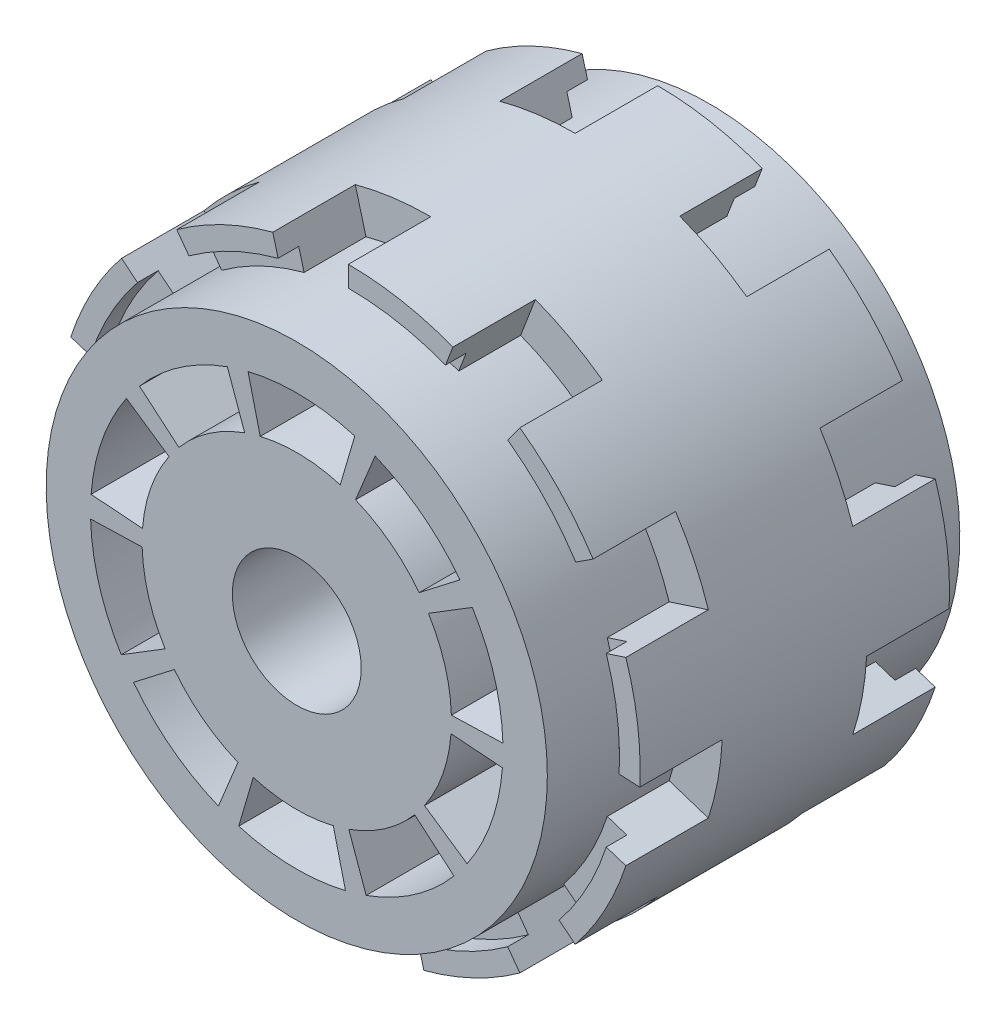
from build123d import *
from build123d.topology import SkipClean

# Parameters (mm, degrees)
SKETCH_1_R               = 28.3
EXTRUDE_1_DEPTH          = 30
SKETCH_4_R               = 24.3
EXTRUDE_2_DEPTH          = 5
EXTRUDE_START            = 5
SKETCH_5_R               = 24.3
EXTRUDE_3_DEPTH          = 5
SKETCH_21_R              = 6.25
CUT_EXTRUDE_11_DEPTH     = 13
SKETCH_23_R              = 2.1
CUT_EXTRUDE_13_DEPTH     = 57.584273434
CUT_EXTRUDE_14_DEPTH     = 47.210280242
SKETCH_27_R              = 22
CUT_EXTRUDE_15_DEPTH     = 7
CUT_EXTRUDE_16_DEPTH     = 57.584273434
CUT_EXTRUDE_17_DEPTH     = 8
PATTERN_CIRCULAR_3_COUNT = 10
CUT_EXTRUDE_START        = -8
CUT_EXTRUDE_19_DEPTH     = 8
PATTERN_CIRCULAR_4_COUNT = 10
CUT_EXTRUDE_START_2      = -2
CUT_EXTRUDE_20_DEPTH     = 2
PATTERN_CIRCULAR_5_COUNT = 10
CUT_EXTRUDE_21_DEPTH     = 2
PATTERN_CIRCULAR_6_COUNT = 10


with BuildPart() as part:
    # 草图1 → 凸台-拉伸1 (new body)
    with BuildSketch(Plane.XY):
        Circle(SKETCH_1_R)
    extrude(amount=EXTRUDE_1_DEPTH)

    # 草图4 → 凸台-拉伸2 (add)
    with BuildSketch(Plane.XY.offset(30)):
        Circle(SKETCH_4_R)
    extrude(amount=EXTRUDE_2_DEPTH)

    # 草图5 → 凸台-拉伸3 (add)
    with BuildSketch(Plane(origin=(0, 0, 0), x_dir=(-1, 0, 0), z_dir=(0, 0, -1)).offset(EXTRUDE_START)):
        with Locations(Location((0, 0, 0), (0, 0, 180))):
            Circle(SKETCH_5_R)
    extrude(amount=-EXTRUDE_3_DEPTH)

    # 草图21 → 切除-拉伸11 (cut)
    with BuildSketch(Plane.XY.offset(35)):
        Circle(SKETCH_21_R)
    extrude(amount=-CUT_EXTRUDE_11_DEPTH, mode=Mode.SUBTRACT)

    # 草图23 → 切除-拉伸13 (cut, through all)
    with BuildSketch(Plane.XY.offset(35)):
        Circle(SKETCH_23_R)
    extrude(amount=-CUT_EXTRUDE_13_DEPTH, mode=Mode.SUBTRACT)

    # 草图26 → 切除-拉伸14 (cut, through all)
    with BuildSketch(Plane.XY.offset(11.9)):
        Polygon((6.912296637, -1.386598427), (4.656977781, 5.292925273), (-2.255318856, 6.6795237), (-6.912296637, 1.386598427), (-4.656977781, -5.292925273), (2.255318856, -6.6795237), align=None)
    extrude(amount=-CUT_EXTRUDE_14_DEPTH, mode=Mode.SUBTRACT)

    # 草图27 → 切除-拉伸15 (cut)
    with BuildSketch(Plane(origin=(0, 0, -5), x_dir=(-1, 0, 0), z_dir=(0, 0, -1))):
        Circle(SKETCH_27_R)
    extrude(amount=-CUT_EXTRUDE_15_DEPTH, mode=Mode.SUBTRACT)

    # 草图31 → 切除-旋转8 (revolve, cut)
    with BuildSketch(Plane(origin=(0, 0, 0), x_dir=(1, 0, 0), z_dir=(0, 1, 0))):
        with BuildLine():
            Line((0, -2), (0, -7))
            add(Edge.make_bspline(
                [(-22, -2), (-11, -7), (0, -7)],
                knots=[0, 0, 0, 0.5, 0.5, 0.5], degree=2))
            Line((-22, -2), (0, -2))
        make_face()
    revolve(axis=Axis((0, 0, -8.390442445), (0, 0, 1)), mode=Mode.SUBTRACT)

    # 草图32 → 切除-拉伸16 (cut, through all)
    with BuildSketch(Plane.XY.offset(35)):
        with BuildLine():
            Line((-3.543658944, 14.575406728), (-4.724878592, 19.433875637))
            ThreePointArc((-4.724878592, 19.433875637), (0.465974877, 19.994570948), (5.625072928, 19.192669292))
            Line((5.625072928, 19.192669292), (4.218804696, 14.394501969))
            ThreePointArc((4.218804696, 14.394501969), (0.349481158, 14.995928211), (-3.543658944, 14.575406728))
        make_face()
        with BuildLine():
            Line((5.700328813, 13.874662209), (7.600438417, 18.499549613))
            ThreePointArc((7.600438417, 18.499549613), (12.129495524, 15.902054532), (15.831947555, 12.220860714))
            Line((15.831947555, 12.220860714), (11.873960667, 9.165645536))
            ThreePointArc((11.873960667, 9.165645536), (9.097121643, 11.926540899), (5.700328813, 13.874662209))
        make_face()
        with BuildLine():
            Line((12.76698471, 7.874268309), (17.022646281, 10.499024412))
            ThreePointArc((17.022646281, 10.499024412), (19.159961147, 5.735493775), (19.991556325, 0.581098716))
            Line((19.991556325, 0.581098716), (14.993667244, 0.435824037))
            ThreePointArc((14.993667244, 0.435824037), (14.36997086, 4.301620331), (12.76698471, 7.874268309))
        make_face()
        with BuildLine():
            Line((14.957086382, -1.133828449), (19.942781843, -1.511771265))
            ThreePointArc((19.942781843, -1.511771265), (18.871972835, -6.621830662), (16.515070066, -11.280623242))
            Line((16.515070066, -11.280623242), (12.386302549, -8.460467431))
            ThreePointArc((12.386302549, -8.460467431), (14.153979626, -4.966372996), (14.957086382, -1.133828449))
        make_face()
        with BuildLine():
            Line((11.434089429, -9.708841276), (15.245452572, -12.945121702))
            ThreePointArc((15.245452572, -12.945121702), (11.375532335, -16.449840853), (6.730388368, -18.833530535))
            Line((6.730388368, -18.833530535), (5.047791276, -14.125147901))
            ThreePointArc((5.047791276, -14.125147901), (8.531649251, -12.33738064), (11.434089429, -9.708841276))
        make_face()
        with BuildLine():
            Line((3.543658944, -14.575406728), (4.724878592, -19.433875637))
            ThreePointArc((4.724878592, -19.433875637), (-0.465974877, -19.994570948), (-5.625072928, -19.192669292))
            Line((-5.625072928, -19.192669292), (-4.218804696, -14.394501969))
            ThreePointArc((-4.218804696, -14.394501969), (-0.349481158, -14.995928211), (3.543658944, -14.575406728))
        make_face()
        with BuildLine():
            Line((-5.700328813, -13.874662209), (-7.600438417, -18.499549613))
            ThreePointArc((-7.600438417, -18.499549613), (-12.129495524, -15.902054532), (-15.831947555, -12.220860714))
            Line((-15.831947555, -12.220860714), (-11.873960667, -9.165645536))
            ThreePointArc((-11.873960667, -9.165645536), (-9.097121643, -11.926540899), (-5.700328813, -13.874662209))
        make_face()
        with BuildLine():
            Line((-12.76698471, -7.874268309), (-17.022646281, -10.499024412))
            ThreePointArc((-17.022646281, -10.499024412), (-19.159961147, -5.735493775), (-19.991556325, -0.581098716))
            Line((-19.991556325, -0.581098716), (-14.993667244, -0.435824037))
            ThreePointArc((-14.993667244, -0.435824037), (-14.36997086, -4.301620331), (-12.76698471, -7.874268309))
        make_face()
        with BuildLine():
            Line((-14.957086382, 1.133828449), (-19.942781843, 1.511771265))
            ThreePointArc((-19.942781843, 1.511771265), (-18.871972835, 6.621830662), (-16.515070066, 11.280623242))
            Line((-16.515070066, 11.280623242), (-12.386302549, 8.460467431))
            ThreePointArc((-12.386302549, 8.460467431), (-14.153979626, 4.966372996), (-14.957086382, 1.133828449))
        make_face()
        with BuildLine():
            Line((-11.434089429, 9.708841276), (-15.245452572, 12.945121702))
            ThreePointArc((-15.245452572, 12.945121702), (-11.375532335, 16.449840853), (-6.730388368, 18.833530535))
            Line((-6.730388368, 18.833530535), (-5.047791276, 14.125147901))
            ThreePointArc((-5.047791276, 14.125147901), (-8.531649251, 12.33738064), (-11.434089429, 9.708841276))
        make_face()
    extrude(amount=-CUT_EXTRUDE_16_DEPTH, mode=Mode.SUBTRACT)

    # 草图33 → 切除-拉伸17 (cut)
    with SkipClean():  # the faces are left unmerged after this step: merging them gives an invalid solid
        with BuildSketch(Plane(origin=(0, 0, 0), x_dir=(-1, 0, 0), z_dir=(0, 0, -1))):
            with BuildLine():
                Line((0, 28.3), (0, 24.3))
                ThreePointArc((0, 24.3), (3.171786471, 24.092110131), (6.289302796, 23.471997579))
                Line((6.289302796, 23.471997579), (7.324578976, 27.335700884))
                ThreePointArc((7.324578976, 27.335700884), (3.69389124, 28.057889577), (0, 28.3))
            make_face()
        cut_extrude_17 = extrude(amount=-CUT_EXTRUDE_17_DEPTH, mode=Mode.SUBTRACT)

    # 阵列(圆周)3: 切除-拉伸17 ×10 about axis
    with SkipClean():  # the faces are left unmerged after this step: merging them gives an invalid solid
        pattern_circular_3_axis = Axis((0, 0, 0), (0, 0, 1))
        for i in range(1, PATTERN_CIRCULAR_3_COUNT):
            add(cut_extrude_17.rotate(pattern_circular_3_axis, i * 360 / PATTERN_CIRCULAR_3_COUNT), mode=Mode.SUBTRACT)

    # 草图37 → 切除-拉伸19 (cut)
    with SkipClean():  # the faces are left unmerged after this step: merging them gives an invalid solid
        with BuildSketch(Plane.XY.offset(30).offset(CUT_EXTRUDE_START)):
            with BuildLine():
                Line((0, 24.3), (0, 28.3))
                ThreePointArc((0, 28.3), (-3.69389124, 28.057889577), (-7.324578976, 27.335700884))
                Line((-7.324578976, 27.335700884), (-6.289302796, 23.471997579))
                ThreePointArc((-6.289302796, 23.471997579), (-3.171786471, 24.092110131), (0, 24.3))
            make_face()
        cut_extrude_19 = extrude(amount=CUT_EXTRUDE_19_DEPTH, mode=Mode.SUBTRACT)

    # 阵列(圆周)4: 切除-拉伸19 ×10 about axis
    with SkipClean():  # the faces are left unmerged after this step: merging them gives an invalid solid
        pattern_circular_4_axis = Axis((0, 0, 0), (0, 0, 1))
        for i in range(1, PATTERN_CIRCULAR_4_COUNT):
            add(cut_extrude_19.rotate(pattern_circular_4_axis, i * 360 / PATTERN_CIRCULAR_4_COUNT), mode=Mode.SUBTRACT)

    # 草图38 → 切除-拉伸20 (cut)
    with SkipClean():  # the faces are left unmerged after this step: merging them gives an invalid solid
        with BuildSketch(Plane.XY.offset(30).offset(CUT_EXTRUDE_START_2)):
            with BuildLine():
                Line((14.283181631, 19.659112963), (15.458752135, 21.277146952))
                ThreePointArc((15.458752135, 21.277146952), (19.077345958, 18.103725341), (22.057035937, 14.324006621))
                Line((22.057035937, 14.324006621), (20.379694801, 13.234728551))
                ThreePointArc((20.379694801, 13.234728551), (17.626597216, 16.727016189), (14.283181631, 19.659112963))
            make_face()
        cut_extrude_20 = extrude(amount=CUT_EXTRUDE_20_DEPTH, mode=Mode.SUBTRACT)

    # 阵列(圆周)5: 切除-拉伸20 ×10 about axis
    pattern_circular_5_axis = Axis((0, 0, 30), (0, 0, -1))
    for i in range(1, PATTERN_CIRCULAR_5_COUNT):
        add(cut_extrude_20.rotate(pattern_circular_5_axis, i * 360 / PATTERN_CIRCULAR_5_COUNT), mode=Mode.SUBTRACT)

    # 草图39 → 切除-拉伸21 (cut)
    with BuildSketch(Plane(origin=(0, 0, 0), x_dir=(-1, 0, 0), z_dir=(0, 0, -1))):
        with BuildLine():
            Line((-14.283181631, 19.659112963), (-15.458752135, 21.277146952))
            ThreePointArc((-15.458752135, 21.277146952), (-19.077345958, 18.103725341), (-22.057035937, 14.324006621))
            Line((-22.057035937, 14.324006621), (-20.379694801, 13.234728551))
            ThreePointArc((-20.379694801, 13.234728551), (-17.626597216, 16.727016189), (-14.283181631, 19.659112963))
        make_face()
    cut_extrude_21 = extrude(amount=-CUT_EXTRUDE_21_DEPTH, mode=Mode.SUBTRACT)

    # 阵列(圆周)6: 切除-拉伸21 ×10 about axis
    pattern_circular_6_axis = Axis((0, 0, 30), (0, 0, -1))
    for i in range(1, PATTERN_CIRCULAR_6_COUNT):
        add(cut_extrude_21.rotate(pattern_circular_6_axis, i * 360 / PATTERN_CIRCULAR_6_COUNT), mode=Mode.SUBTRACT)


solid = part.part
